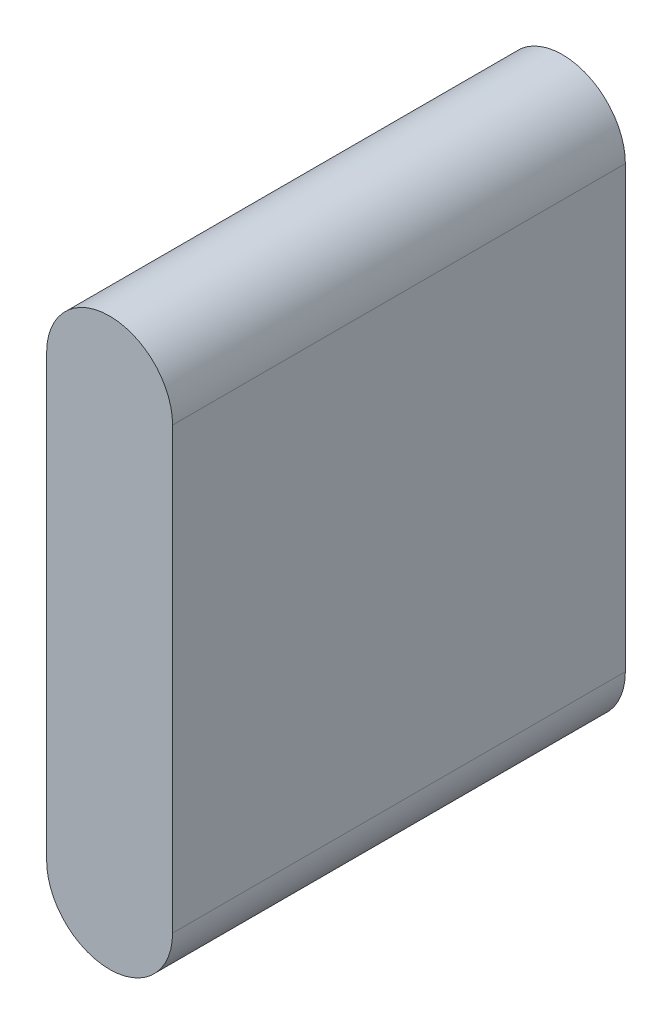
from build123d import *

# Parameters (mm, degrees)
SKETCH1_W           = 80
SKETCH1_H           = 100
BOSS_EXTRUDE1_DEPTH = 22.25
CUT_EXTRUDE1_DEPTH  = 102.456110922


with BuildPart() as part:
    # Sketch1 → Boss-Extrude1 (new body)
    with BuildSketch(Plane(origin=(0, 0, 0), x_dir=(0, 0, -1), z_dir=(1, 0, 0))):
        with Locations((-11.920831682, -8.294767718)):
            Rectangle(SKETCH1_W, SKETCH1_H)
    extrude(amount=-BOSS_EXTRUDE1_DEPTH)

    # Sketch2 → Cut-Extrude1 (cut, through all)
    with BuildSketch(Plane(origin=(0, 0, -28.079168318), x_dir=(-1, 0, 0), z_dir=(0, 0, -1))):
        with BuildLine():
            Line((22.25, -47.164767718), (22.25, -58.294767718))
            Line((22.25, -58.294767718), (0, -58.294767718))
            Line((0, -58.294767718), (0, -47.164767718))
            ThreePointArc((0, -47.164767718), (11.125, -58.289767718), (22.25, -47.164767718))
        make_face()
        with BuildLine():
            Line((0, 41.705232282), (0, 30.575232282))
            ThreePointArc((0, 30.575232282), (11.125, 41.700232282), (22.25, 30.575232282))
            Line((22.25, 30.575232282), (22.25, 41.705232282))
            Line((22.25, 41.705232282), (0, 41.705232282))
        make_face()
    extrude(amount=-CUT_EXTRUDE1_DEPTH, mode=Mode.SUBTRACT)


solid = part.part
